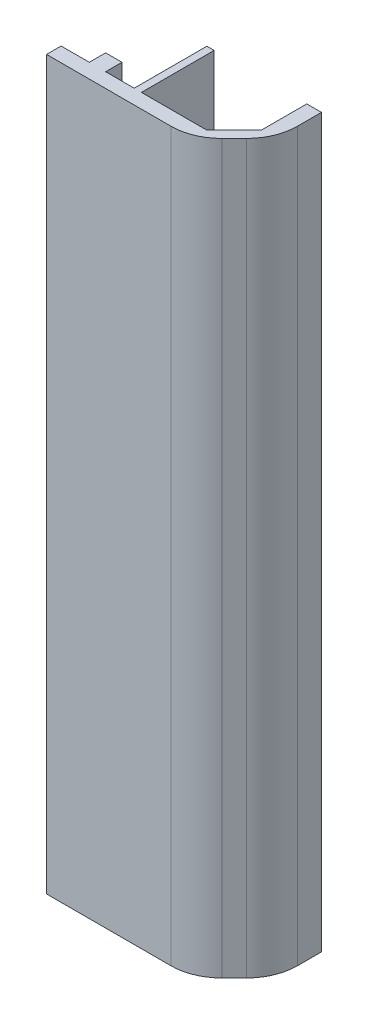
from build123d import *

# Parameters (mm, degrees)
EXTRUDE_1_DEPTH = 200
FILLET_1_R      = 14
SKETCH_2_W      = 2
SKETCH_2_H      = 200
EXTRUDE_2_DEPTH = 20


with BuildPart() as part:
    # 草圖1 → 填料-伸長1 (new body)
    with BuildSketch(Plane(origin=(0, 0, 0), x_dir=(1, 0, 0), z_dir=(0, 1, 0))):
        Polygon((-27.501723192, 6.859259259), (-23.001723192, 6.859259259), (-23.001723192, 2.359259259), (4.748276808, 2.359259259), (12.331610141, 9.942592593), (12.331610141, 22.359259259), (16.361610141, 22.359259259), (16.361610141, 9.942592593), (4.778276808, -1.640740741), (-35.251723192, -1.640740741), (-35.251723192, 2.359259259), (-27.501723192, 2.359259259), align=None)
    extrude(amount=EXTRUDE_1_DEPTH)

    # 圓角1
    fillet_1_edges = [part.edges().sort_by_distance(p)[0] for p in [
        (16.361610141, 100, -9.942592593),
        (4.778276808, 100, 1.640740741),
    ]]
    fillet(fillet_1_edges, radius=FILLET_1_R)

    # 草圖2 → 填料-伸長2 (add)
    with BuildSketch(Plane(origin=(0, 0, -2.359259259), x_dir=(-1, 0, 0), z_dir=(0, 0, -1))):
        with Locations((14.151723192, 100)):
            Rectangle(SKETCH_2_W, SKETCH_2_H)
    extrude(amount=EXTRUDE_2_DEPTH)


solid = part.part
